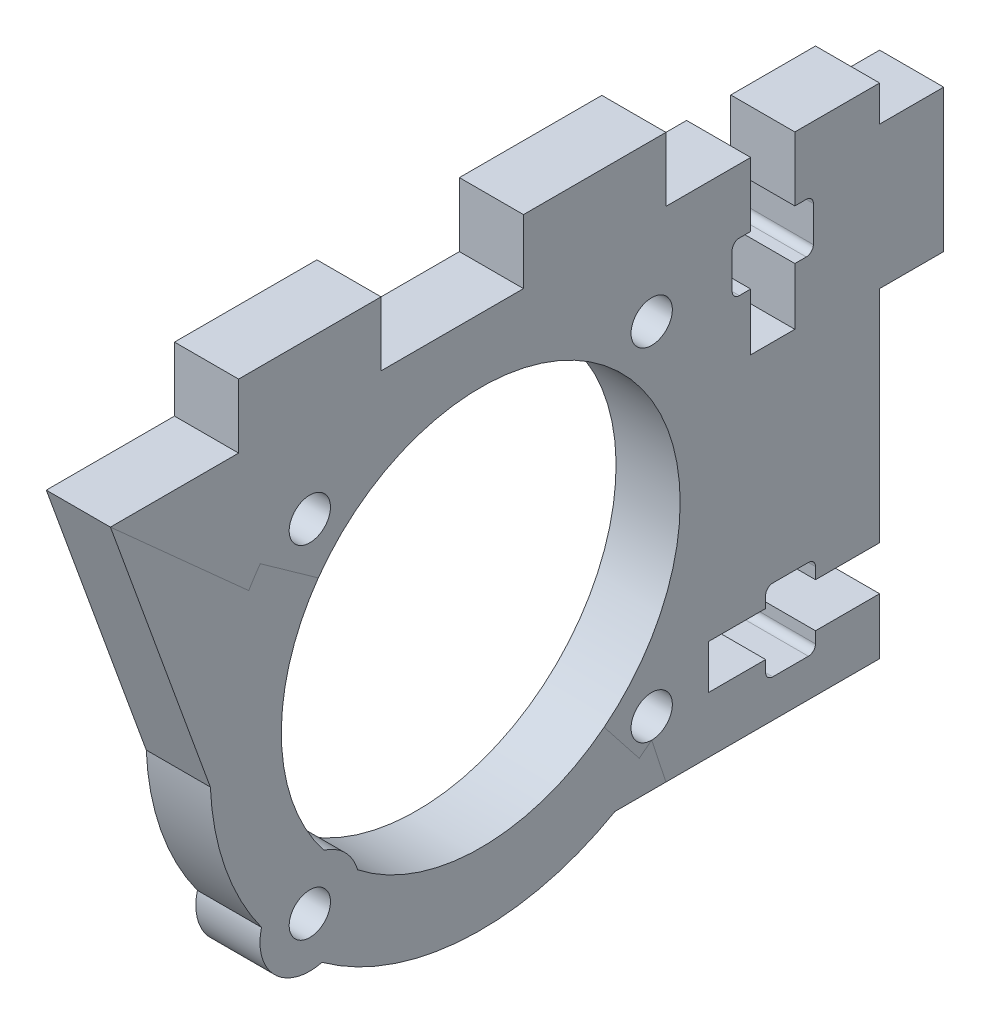
from build123d import *

# Parameters (mm, degrees)
BOSS_EXTRUDE1_DEPTH  = 4.5
SKETCH2_W            = 9
SKETCH2_H            = 10
BOSS_EXTRUDE2_DEPTH  = 4.5
BOSS_EXTRUDE3_DEPTH  = 4.5
CUT_EXTRUDE1_DEPTH   = 65.507751472
SKETCH5_W            = 10
SKETCH5_H            = 4.5
BOSS_EXTRUDE4_DEPTH  = 4.5
CUT_EXTRUDE4_DEPTH   = 65.507751472
SKETCH12_R           = 14
SKETCH12_R_2         = 1.45
FANCUTOUT_DEPTH      = 65.507751472
BOSS_EXTRUDE7_DEPTH  = 4.5
SKETCH14_R           = 3.5
BOSS_EXTRUDE8_DEPTH  = 4.5
SKETCH15_R           = 1.45
CUT_EXTRUDE6_DEPTH   = 66.897647909
BOSS_EXTRUDE13_DEPTH = 4.5
BOSS_EXTRUDE15_DEPTH = 4.5


with BuildPart() as part:
    # Sketch1 → Boss-Extrude1 (new body)
    with BuildSketch(Plane(origin=(0, 0, 0), x_dir=(0, 0, -1), z_dir=(1, 0, 0))):
        Polygon((0, 0), (0, -35), (-54, 0), align=None)
    extrude(amount=BOSS_EXTRUDE1_DEPTH)

    # Sketch2 → Boss-Extrude2 (add, through all)
    with BuildSketch(Plane(origin=(4.5, 0, 0), x_dir=(0, 0, -1), z_dir=(1, 0, 0))):
        with Locations((0, -7.5)):
            Rectangle(SKETCH2_W, SKETCH2_H)
    extrude(amount=-BOSS_EXTRUDE2_DEPTH)

    # Sketch3 → Boss-Extrude3 (add, through all)
    with BuildSketch(Plane(origin=(4.5, 0, 0), x_dir=(0, 0, -1), z_dir=(1, 0, 0))):
        Polygon((0, -35), (-15, -35), (-54, 0), (0, -25), align=None)
    extrude(amount=-BOSS_EXTRUDE3_DEPTH)

    # Sketch4 → Cut-Extrude1 (cut, through all)
    with BuildSketch(Plane(origin=(4.5, 0, 0), x_dir=(0, 0, -1), z_dir=(1, 0, 0))):
        with BuildLine():
            Line((0, -31.05), (0, -27.95))
            Line((0, -27.95), (-4.5, -27.95))
            Line((-4.5, -27.95), (-4.5, -27.15))
            ThreePointArc((-4.5, -27.15), (-4.646446609, -26.796446609), (-5, -26.65))
            Line((-5, -26.65), (-7.5, -26.65))
            ThreePointArc((-7.5, -26.65), (-7.853553391, -26.796446609), (-8, -27.15))
            Line((-8, -27.15), (-8, -27.95))
            Line((-8, -27.95), (-12, -27.95))
            Line((-12, -27.95), (-12, -31.05))
            Line((-12, -31.05), (-8, -31.05))
            Line((-8, -31.05), (-8, -31.85))
            ThreePointArc((-8, -31.85), (-7.853553391, -32.203553391), (-7.5, -32.35))
            Line((-7.5, -32.35), (-5, -32.35))
            ThreePointArc((-5, -32.35), (-4.646446609, -32.203553391), (-4.5, -31.85))
            Line((-4.5, -31.85), (-4.5, -31.05))
            Line((-4.5, -31.05), (0, -31.05))
        make_face()
    extrude(amount=-CUT_EXTRUDE1_DEPTH, mode=Mode.SUBTRACT)

    # Sketch5 → Boss-Extrude4 (add, through all)
    with BuildSketch(Plane(origin=(4.5, 0, 0), x_dir=(0, 0, -1), z_dir=(1, 0, 0))):
        with Locations((-20, 2.25)):
            Rectangle(SKETCH5_W, SKETCH5_H)
        with Locations((-40, 2.25)):
            Rectangle(SKETCH5_W, SKETCH5_H)
    extrude(amount=-BOSS_EXTRUDE4_DEPTH)

    # Sketch11 → Cut-Extrude4 (cut, through all)
    with BuildSketch(Plane.ZY):
        with BuildLine():
            Line((5.95, -12), (9.05, -12))
            Line((9.05, -12), (9.05, -8))
            Line((9.05, -8), (9.85, -8))
            ThreePointArc((9.85, -8), (10.203553391, -7.853553391), (10.35, -7.5))
            Line((10.35, -7.5), (10.35, -5))
            ThreePointArc((10.35, -5), (10.203553391, -4.646446609), (9.85, -4.5))
            Line((9.85, -4.5), (9.05, -4.5))
            Line((9.05, -4.5), (9.05, 0))
            Line((9.05, 0), (5.95, 0))
            Line((5.95, 0), (5.95, -4.5))
            Line((5.95, -4.5), (5.15, -4.5))
            ThreePointArc((5.15, -4.5), (4.796446609, -4.646446609), (4.65, -5))
            Line((4.65, -5), (4.65, -7.5))
            ThreePointArc((4.65, -7.5), (4.796446609, -7.853553391), (5.15, -8))
            Line((5.15, -8), (5.95, -8))
            Line((5.95, -8), (5.95, -12))
        make_face()
    extrude(amount=-CUT_EXTRUDE4_DEPTH, mode=Mode.SUBTRACT)

    # Sketch12 → FanCutout (cut, through all)
    with BuildSketch(Plane.ZY):
        with Locations((28, -18.5)):
            Circle(SKETCH12_R)
        with Locations((16, -6.5)):
            Circle(SKETCH12_R_2)
        with Locations((40, -6.5)):
            Circle(SKETCH12_R_2)
        with Locations((16, -30.5)):
            Circle(SKETCH12_R_2)
    extrude(amount=-FANCUTOUT_DEPTH, mode=Mode.SUBTRACT)

    # Sketch13 → Boss-Extrude7 (add, through all)
    with BuildSketch(Plane.ZY):
        with BuildLine():
            Line((39.407071777, -10.383429697), (43.481025983, -7.484654589))
            ThreePointArc((43.481025983, -7.484654589), (41.102709954, -32.259323816), (16.241427695, -33.424341772))
            Line((16.241427695, -33.424341772), (19.335788828, -29.496883411))
            ThreePointArc((19.335788828, -29.496883411), (37.654628387, -28.638449127), (39.407071777, -10.383429697))
        make_face()
    extrude(amount=-BOSS_EXTRUDE7_DEPTH)

    # Sketch14 → Boss-Extrude8 (add, through all)
    with BuildSketch(Plane.ZY):
        with Locations((40, -30.5)):
            Circle(SKETCH14_R)
    extrude(amount=-BOSS_EXTRUDE8_DEPTH)

    # Sketch15 → Cut-Extrude6 (cut, through all)
    with BuildSketch(Plane.ZY):
        with Locations((40, -30.5)):
            Circle(SKETCH15_R)
    extrude(amount=-CUT_EXTRUDE6_DEPTH, mode=Mode.SUBTRACT)

    # Sketch24 → Boss-Extrude13 (add, through all)
    with BuildSketch(Plane.ZY):
        Polygon((15, -35), (20, -35), (16, -31.95), align=None)
    extrude(amount=-BOSS_EXTRUDE13_DEPTH)

    # Sketch25 → Boss-Extrude15 (add, through all)
    with BuildSketch(Plane.ZY):
        Polygon((54, 0), (46.982638315, -19.312060719), (44.28744936, -8.7163916), align=None)
    extrude(amount=-BOSS_EXTRUDE15_DEPTH)


solid = part.part
